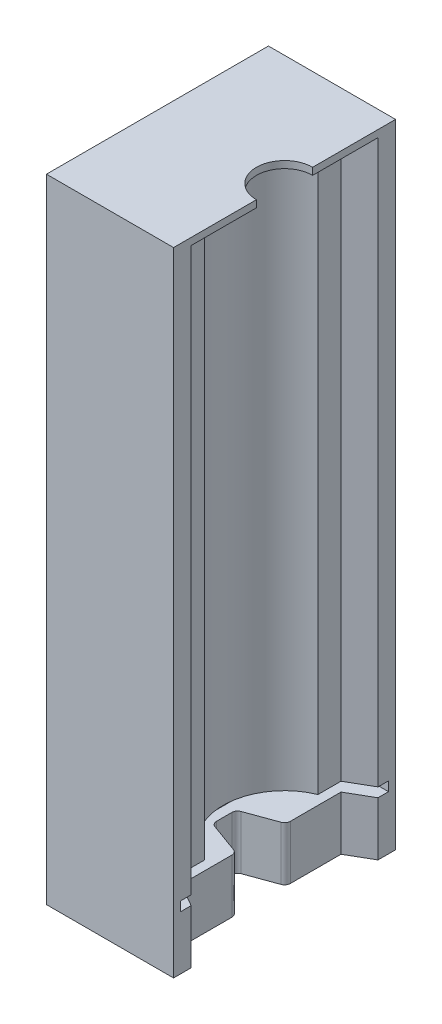
from build123d import *

# Parameters (mm, degrees)
EXTRUDE_1_DEPTH     = 96
EXTRUDE_2_DEPTH     = 1.2
SKETCH_3_R          = 1.6
SKETCH_3_R_2        = 0.6
EXTRUDE_3_DEPTH     = 1.6
SKETCH_4_R          = 0.6
SKETCH_4_R_2        = 1.6
EXTRUDE_4_DEPTH     = 1.2
FILLET_1_R          = 1
SKETCH_5_R          = 1.5
CUT_EXTRUDE_1_DEPTH = 2
SKETCH_6_R          = 1.5
CUT_EXTRUDE_2_DEPTH = 2
EXTRUDE_START       = 8
EXTRUDE_6_DEPTH     = 8
SKETCH_10_R         = 0.6
EXTRUDE_7_DEPTH     = 4


with BuildPart() as part:
    # Эскиз1 → Бобышка-Вытянуть1 (new body)
    with BuildSketch(Plane(origin=(0, 0, 0), x_dir=(1, 0, 0), z_dir=(0, 1, 0))):
        with BuildLine():
            Line((0, -18.95), (0, -15.95))
            Line((0, -15.95), (-4, -13.640598923))
            Line((-4, -13.640598923), (-4, -9.708243919))
            ThreePointArc((-4, -9.708243919), (-10.5, 0), (-4, 9.708243919))
            Line((-4, 9.708243919), (-4, 13.640598923))
            Line((-4, 13.640598923), (0, 15.95))
            Line((0, 15.95), (0, 18.95))
            Line((0, 18.95), (-21.7, 18.95))
            Line((-21.7, 18.95), (-21.7, 17.75))
            Line((-21.7, 17.75), (-11.7, 17.75))
            Line((-11.7, 17.75), (-11.7, -17.75))
            Line((-11.7, -17.75), (-21.7, -17.75))
            Line((-21.7, -17.75), (-21.7, -18.95))
            Line((-21.7, -18.95), (0, -18.95))
        make_face()
    extrude(amount=EXTRUDE_1_DEPTH)

    # Эскиз2 → Бобышка-Вытянуть2 (add)
    with BuildSketch(Plane(origin=(0, 96, 0), x_dir=(1, 0, 0), z_dir=(0, 1, 0))):
        with BuildLine():
            Line((0, -4.8), (0, -18.95))
            Line((0, -18.95), (-21.7, -18.95))
            Line((-21.7, -18.95), (-21.7, 18.95))
            Line((-21.7, 18.95), (0, 18.95))
            Line((0, 18.95), (0, 4.8))
            ThreePointArc((0, 4.8), (-4.8, 0), (0, -4.8))
        make_face()
    extrude(amount=EXTRUDE_2_DEPTH)

    # Эскиз3 → Бобышка-Вытянуть3 (add)
    with BuildSketch(Plane.XZ):
        Polygon((0, -18.95), (0, -17.75), (-7, -17.75), (-12, -9.089745962), (-12, 9.089745962), (-7, 17.75), (0, 17.75), (0, 18.95), (-21.7, 18.95), (-21.7, -18.95), align=None)
        with Locations(Location((-17.7, 2.45, 0), (0, 0, 270))):
            Circle(SKETCH_3_R, mode=Mode.SUBTRACT)
        with Locations(Location((-17.7, -2.05, 0), (0, 0, 270))):
            Circle(SKETCH_3_R_2, mode=Mode.SUBTRACT)
        with Locations(Location((-17.7, 6.95, 0), (0, 0, 270))):
            Circle(SKETCH_3_R_2, mode=Mode.SUBTRACT)
    extrude(amount=EXTRUDE_3_DEPTH)

    # Эскиз4 → Бобышка-Вытянуть4 (add)
    with BuildSketch(Plane.XZ.offset(1.6)):
        Polygon((0, -17.75), (0, -18.95), (-21.7, -18.95), (-21.7, 18.95), (0, 18.95), (0, 17.75), (0, 15.95), (-4, 13.640598923), (-4, 9.708243919), (-4, 4.295838364), (-10.307764064, 2), (-10.307764064, -2), (-4, -4.295838364), (-4, -9.708243919), (-4, -13.640598923), (0, -15.95), align=None)
        with Locations(Location((-17.7, 6.95, 0), (0, 0, 270))):
            Circle(SKETCH_4_R, mode=Mode.SUBTRACT)
        with Locations(Location((-17.7, 2.45, 0), (0, 0, 270))):
            Circle(SKETCH_4_R_2, mode=Mode.SUBTRACT)
        with Locations(Location((-17.7, -2.05, 0), (0, 0, 270))):
            Circle(SKETCH_4_R, mode=Mode.SUBTRACT)
    extrude(amount=EXTRUDE_4_DEPTH)

    # Скругление1
    fillet_1_edges = [part.edges().sort_by_distance(p)[0] for p in [
        (-4, -2.2, -4.295838364),
        (-10.307764064, -2.2, -2),
        (-10.307764064, -2.2, 2),
        (-4, -2.2, 4.295838364),
    ]]
    fillet(fillet_1_edges, radius=FILLET_1_R)

    # Эскиз5 → Вырез-Вытянуть1 (cut)
    with BuildSketch(Plane.XZ.offset(2.8)):
        with Locations(Location((-13.2, 10.25, 0), (0, 0, 270))):
            Circle(SKETCH_5_R)
    extrude(amount=-CUT_EXTRUDE_1_DEPTH, mode=Mode.SUBTRACT)

    # Эскиз6 → Вырез-Вытянуть2 (cut)
    with BuildSketch(Plane.XZ.offset(2.8)):
        with Locations(Location((-13.2, -10.25, 0), (0, 0, 90))):
            Circle(SKETCH_6_R)
    extrude(amount=-CUT_EXTRUDE_2_DEPTH, mode=Mode.SUBTRACT)

    # Эскиз9 → Бобышка-Вытянуть6 (add)
    with BuildSketch(Plane.XZ.offset(2.8).offset(EXTRUDE_START)):
        with BuildLine():
            Line((-9.649784207, 2.239485083), (-4.657979857, 4.056353282))
            ThreePointArc((-4.657979857, 4.056353282), (-4.180847956, 4.422469466), (-4, 4.996045902))
            Line((-4, 4.996045902), (-4, 13.640598923))
            Line((-4, 13.640598923), (0, 15.95))
            Line((0, 15.95), (0, 18.95))
            Line((0, 18.95), (-21.7, 18.95))
            Line((-21.7, 18.95), (-21.7, -18.95))
            Line((-21.7, -18.95), (0, -18.95))
            Line((0, -18.95), (0, -15.95))
            Line((0, -15.95), (-4, -13.640598923))
            Line((-4, -13.640598923), (-4, -4.996045902))
            ThreePointArc((-4, -4.996045902), (-4.180847956, -4.422469466), (-4.657979857, -4.056353282))
            Line((-4.657979857, -4.056353282), (-9.649784207, -2.239485083))
            ThreePointArc((-9.649784207, -2.239485083), (-10.126916108, -1.873368898), (-10.307764064, -1.299792462))
            Line((-10.307764064, -1.299792462), (-10.307764064, 1.299792462))
            ThreePointArc((-10.307764064, 1.299792462), (-10.126916108, 1.873368898), (-9.649784207, 2.239485083))
        make_face()
        with BuildLine():
            Line((-1.2, 16.642820323), (-1.2, 17.75))
            Line((-1.2, 17.75), (-20.5, 17.75))
            Line((-20.5, 17.75), (-20.5, -17.75))
            Line((-20.5, -17.75), (-1.2, -17.75))
            Line((-1.2, -17.75), (-1.2, -16.642820323))
            Line((-1.2, -16.642820323), (-5.2, -14.333419246))
            Line((-5.2, -14.333419246), (-5.2, -5.13608741))
            Line((-5.2, -5.13608741), (-10.060208379, -3.367116228))
            ThreePointArc((-10.060208379, -3.367116228), (-11.109898561, -2.561660622), (-11.507764064, -1.299792462))
            Line((-11.507764064, -1.299792462), (-11.507764064, 1.299792462))
            ThreePointArc((-11.507764064, 1.299792462), (-11.109898561, 2.561660622), (-10.060208379, 3.367116228))
            Line((-10.060208379, 3.367116228), (-5.2, 5.13608741))
            Line((-5.2, 5.13608741), (-5.2, 14.333419246))
            Line((-5.2, 14.333419246), (-1.2, 16.642820323))
        make_face(mode=Mode.SUBTRACT)
    extrude(amount=-EXTRUDE_6_DEPTH)

    # Эскиз10 → Бобышка-Вытянуть7 (add)
    # profile 1 of 4: a face of its own
    with BuildSketch(Plane.XZ.offset(10.8)):
        Polygon((-1.2, 17.75), (-1.2, 16.642820323), (-5.2, 14.333419246), (-5.2, 17.75), align=None)
        with Locations(Location((-3.6, 16.55, 0), (0, 0, 270))):
            Circle(SKETCH_10_R, mode=Mode.SUBTRACT)
    # profile 2 of 4: a face of its own
    with BuildSketch(Plane.XZ.offset(10.8)):
        Polygon((-16.5, 17.75), (-20.5, 13.75), (-20.5, 17.75), align=None)
        with Locations(Location((-19.3, 16.55, 0), (0, 0, 270))):
            Circle(SKETCH_10_R, mode=Mode.SUBTRACT)
    # profile 3 of 4: a face of its own
    with BuildSketch(Plane.XZ.offset(10.8)):
        Polygon((-20.5, -13.75), (-20.5, -17.75), (-16.5, -17.75), align=None)
        with Locations(Location((-19.3, -16.55, 0), (0, 0, 90))):
            Circle(SKETCH_10_R, mode=Mode.SUBTRACT)
    # profile 4 of 4: a face of its own
    with BuildSketch(Plane.XZ.offset(10.8)):
        Polygon((-5.2, -14.333419246), (-5.2, -17.75), (-1.2, -17.75), (-1.2, -16.642820323), align=None)
        with Locations(Location((-3.6, -16.55, 0), (0, 0, 90))):
            Circle(SKETCH_10_R, mode=Mode.SUBTRACT)
    extrude(amount=-EXTRUDE_7_DEPTH)


solid = part.part
